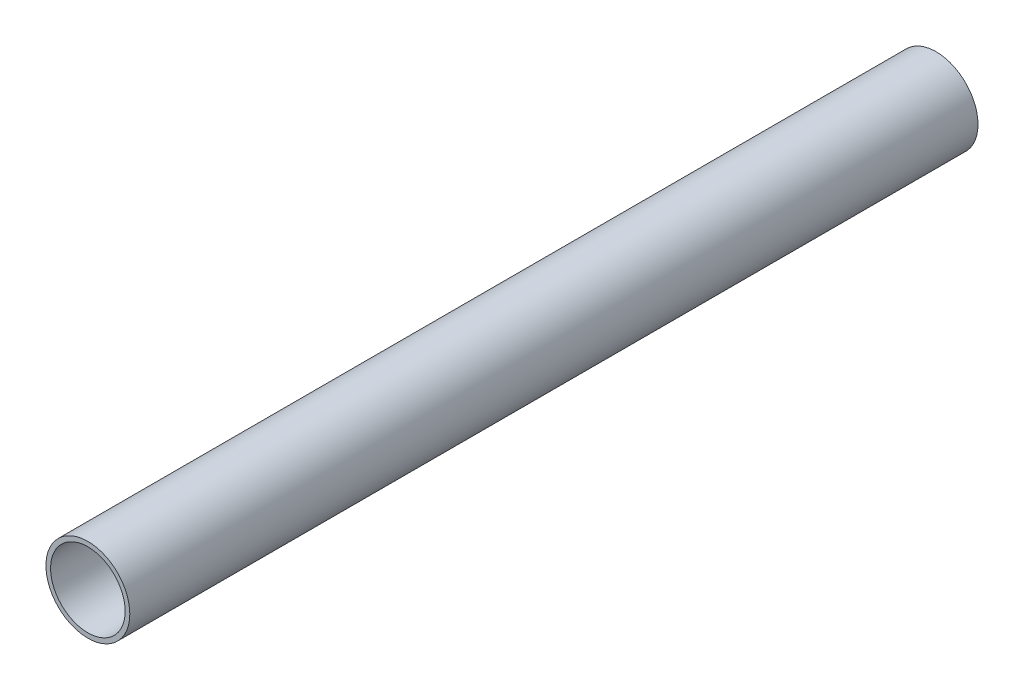
from build123d import *

# Parameters (mm, degrees)
CROQUIS1_R              = 9
CROQUIS1_R_2            = 8
SALIENTE_EXTRUIR1_DEPTH = 91


with BuildPart() as part:
    # Croquis1 → Saliente-Extruir1 (new, symmetric)
    with BuildSketch(Plane.XY):
        Circle(CROQUIS1_R)
        Circle(CROQUIS1_R_2, mode=Mode.SUBTRACT)
    extrude(amount=SALIENTE_EXTRUIR1_DEPTH, both=True)


solid = part.part
